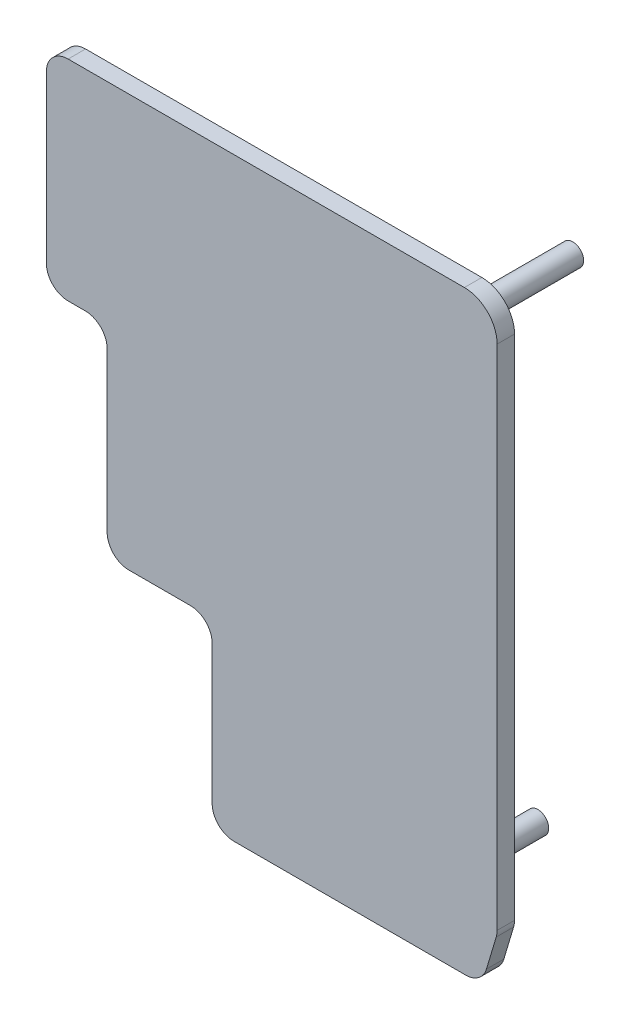
from build123d import *

# Parameters (mm, degrees)
BOSS_EXTRUDE1_DEPTH = 1.6
SKETCH2_R           = 1
BOSS_EXTRUDE2_DEPTH = 9
FILLET1_R           = 2


with BuildPart() as part:
    # Sketch1 → Boss-Extrude1 (new body)
    with BuildSketch(Plane.XY):
        with BuildLine():
            Line((65.63056034, 41.616019999), (27.245760636, 41.591406461))
            Line((27.245760636, 41.591406461), (27.245760636, 22.351411618))
            Line((27.245760636, 22.351411618), (32.827326689, 22.351411618))
            Line((32.827326689, 22.351411618), (32.827326689, 3.745377262))
            Line((32.827326689, 3.745377262), (42.468635401, 3.745377262))
            Line((42.468635401, 3.745377262), (42.468635401, -13.000053658))
            Line((42.468635401, -13.000053658), (67.226484424, -13.000053658))
            Line((67.226484424, -13.000053658), (68.632483949, -8.295222112))
            Line((68.632483949, -8.295222112), (68.632483949, 38.616020588))
            ThreePointArc((68.632483949, 38.616020588), (67.753124087, 40.738020931), (65.63056034, 41.616019999))
        make_face()
    extrude(amount=BOSS_EXTRUDE1_DEPTH)

    # Sketch2 → Boss-Extrude2 (add)
    with BuildSketch(Plane(origin=(0, 0, 0), x_dir=(-1, 0, 0), z_dir=(0, 0, -1))):
        with Locations(Location((-30.536864632, 26.322094416, 0), (0, 0, 180))):
            Circle(SKETCH2_R)
        with Locations(Location((-45.827551279, -10.739617505, 0), (0, 0, 180))):
            Circle(SKETCH2_R)
        with Locations(Location((-61.773553069, -8.118356937, 0), (0, 0, 180))):
            Circle(SKETCH2_R)
        with Locations(Location((-64.977315986, 38.627456528, 0), (0, 0, 180))):
            Circle(SKETCH2_R)
    extrude(amount=BOSS_EXTRUDE2_DEPTH)

    # Fillet1
    fillet1_edges = [part.edges().sort_by_distance(p)[0] for p in [
        (68.632483949, -8.295222112, 0.8),
        (67.226484424, -13.000053658, 0.8),
        (42.468635401, -13.000053658, 0.8),
        (42.468635401, 3.745377262, 0.8),
        (32.827326689, 3.745377262, 0.8),
        (32.827326689, 22.351411618, 0.8),
        (27.245760636, 22.351411618, 0.8),
        (27.245760636, 41.591406461, 0.8),
    ]]
    fillet(fillet1_edges, radius=FILLET1_R)


solid = part.part
